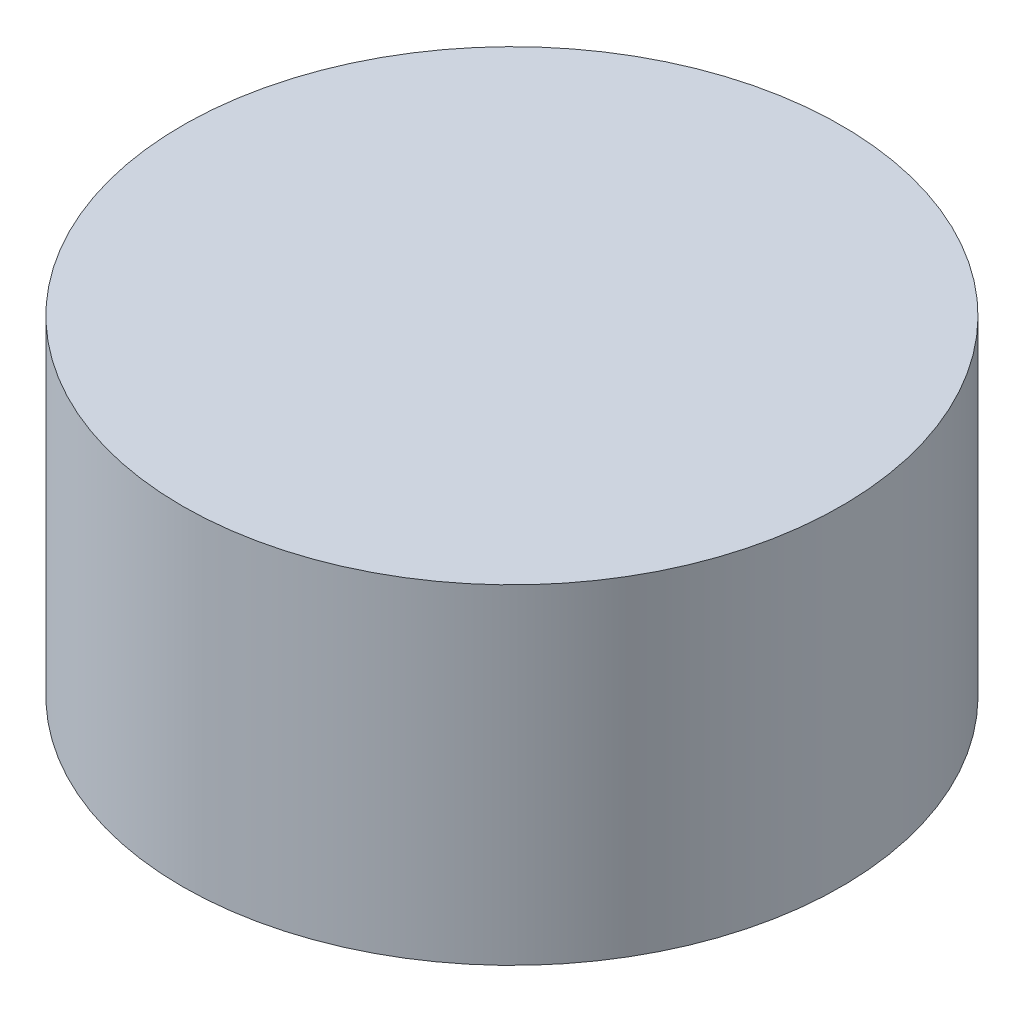
from build123d import *

# Parameters (mm, degrees)
SKETCH1_R           = 1
BOSS_EXTRUDE1_DEPTH = 1


with BuildPart() as part:
    # Sketch1 → Boss-Extrude1 (new body)
    with BuildSketch(Plane(origin=(0, 0, 0), x_dir=(1, 0, 0), z_dir=(0, 1, 0))):
        with Locations(Location((0, 0, 0), (0, 0, 270))):
            Circle(SKETCH1_R)
    extrude(amount=BOSS_EXTRUDE1_DEPTH)


solid = part.part
